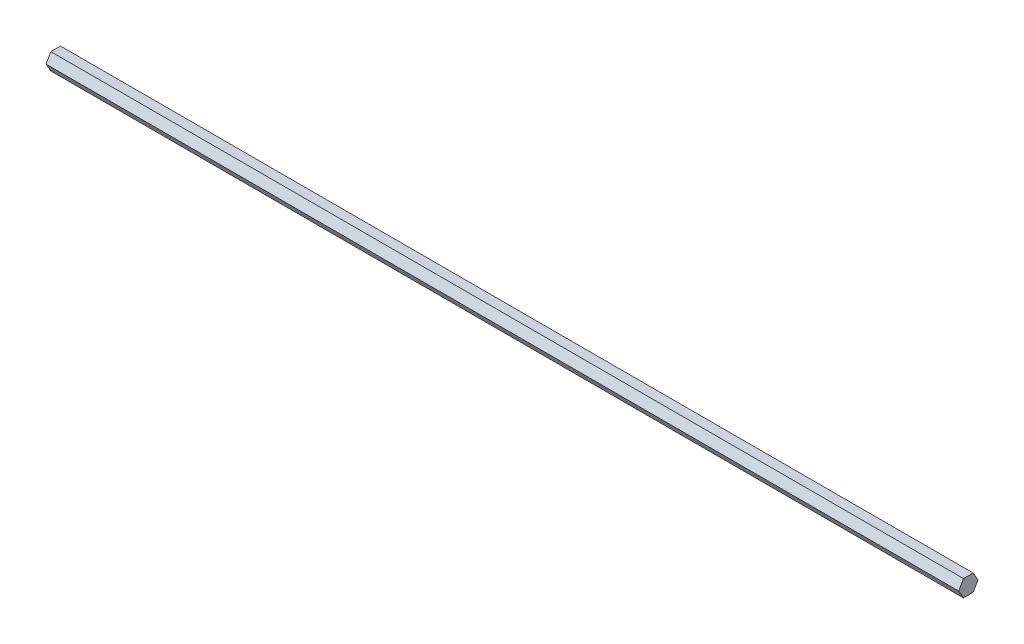
from build123d import *

# Parameters (mm, degrees)
BOSS_EXTRUDE1_DEPTH = 692.15


with BuildPart() as part:
    # Sketch1 → Boss-Extrude1 (new body)
    with BuildSketch(Plane(origin=(0, 0, 0), x_dir=(0, 0, -1), z_dir=(1, 0, 0))):
        Polygon((7.332348419, 0), (3.666174209, 6.35), (-3.666174209, 6.35), (-7.332348419, 0), (-3.666174209, -6.35), (3.666174209, -6.35), align=None)
    extrude(amount=BOSS_EXTRUDE1_DEPTH)


solid = part.part
